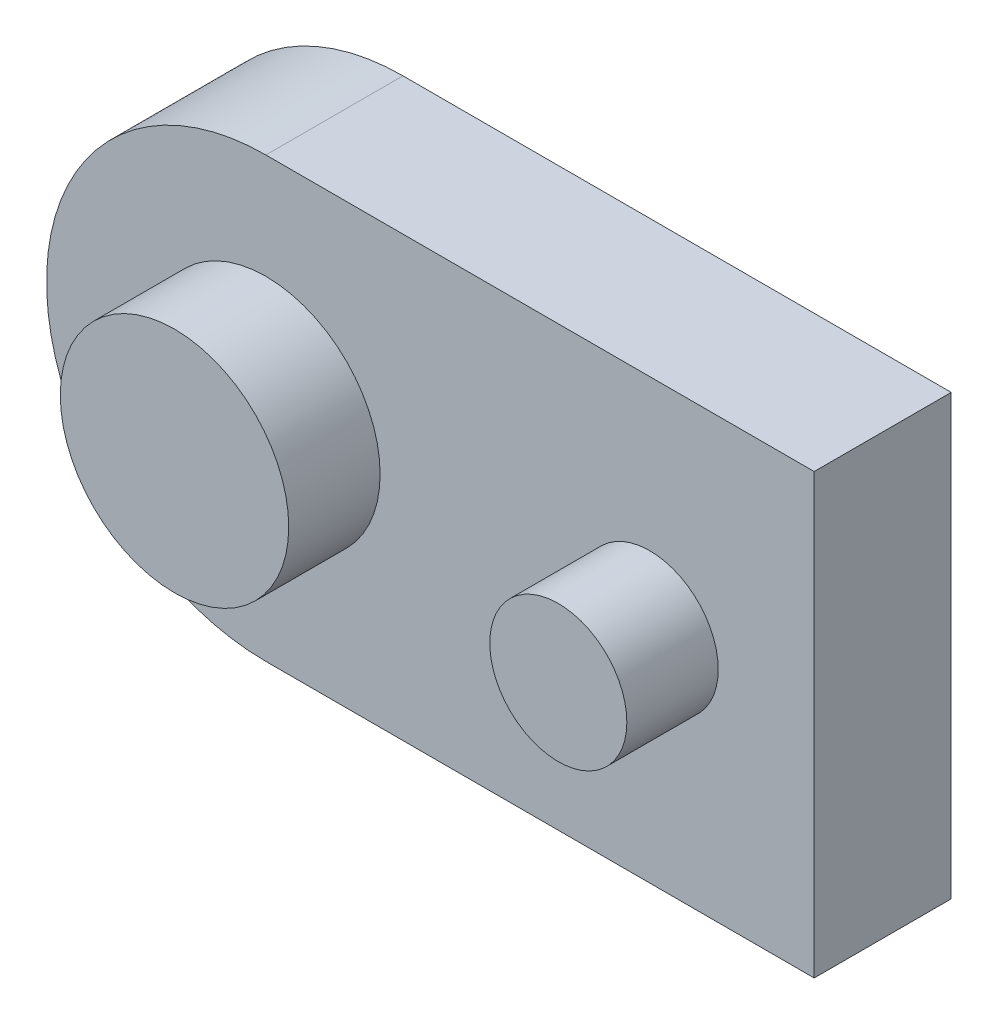
from build123d import *

# Parameters (mm, degrees)
BOSS_EXTRUDE1_DEPTH = 3
SKETCH2_R           = 2.5
SKETCH2_R_2         = 1.5
BOSS_EXTRUDE2_DEPTH = 5


with BuildPart() as part:
    # Sketch3 → Boss-Extrude1 (new body)
    with BuildSketch(Plane.XY):
        with BuildLine():
            Line((0, -4.8), (12, -4.8))
            Line((12, -4.8), (12, 4.8))
            Line((12, 4.8), (0, 4.8))
            ThreePointArc((0, 4.8), (-4.8, 0), (0, -4.8))
        make_face()
    extrude(amount=BOSS_EXTRUDE1_DEPTH)

    # Sketch2 → Boss-Extrude2 (add)
    with BuildSketch(Plane.XY):
        Circle(SKETCH2_R)
        with Locations((8.4, 0)):
            Circle(SKETCH2_R_2)
    extrude(amount=BOSS_EXTRUDE2_DEPTH)


solid = part.part
